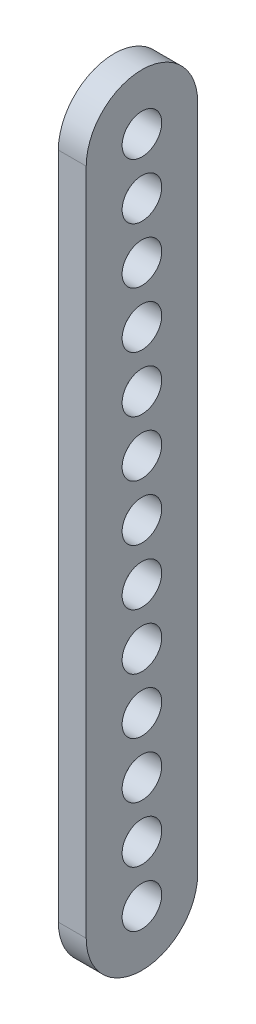
from build123d import *

# Parameters (mm, degrees)
BOSS_EXTRUDE1_DEPTH          = 2.5
F_5_32_0_14_DIAMETER_HOLE1_D = 3.556
LPATTERN1_COUNT              = 7
LPATTERN1_PITCH              = 5
MIRROR1_COPY_1_D             = 3.556
MIRROR1_COPY_2_D             = 3.556
MIRROR1_COPY_3_D             = 3.556
MIRROR1_COPY_4_D             = 3.556
MIRROR1_COPY_5_D             = 3.556
MIRROR1_COPY_6_D             = 3.556
MIRROR1_COPY_7_D             = 3.556


with BuildPart() as part:
    # Sketch1 → Boss-Extrude1 (new body)
    with BuildSketch(Plane(origin=(0, 0, 0), x_dir=(0, 0, -1), z_dir=(1, 0, 0))):
        with BuildLine():
            Line((5, 30), (5, -30))
            ThreePointArc((5, -30), (0, -35), (-5, -30))
            Line((-5, -30), (-5, 30))
            ThreePointArc((-5, 30), (0, 35), (5, 30))
        make_face()
    extrude(amount=BOSS_EXTRUDE1_DEPTH)

    # 5/32 (0.14) Diameter Hole1 (through all)
    with Locations(Plane(origin=(2.5, 0, 0), x_dir=(0, 0, -1), z_dir=(1, 0, 0))):
        with Locations((0, 0)):
            f_5_32_0_14_diameter_hole1 = Hole(F_5_32_0_14_DIAMETER_HOLE1_D / 2)

    # LPattern1: 5/32 (0.14) Diameter Hole1 ×7
    with Locations(*[(0, i * LPATTERN1_PITCH, 0) for i in range(1, LPATTERN1_COUNT)]):
        add(f_5_32_0_14_diameter_hole1, mode=Mode.SUBTRACT)

    # Mirror1 copy 1 (through all)
    with Locations(Plane(origin=(2.5, -5, 0), x_dir=(0, 0, -1), z_dir=(1, 0, 0))):
        with Locations((0, 0)):
            Hole(MIRROR1_COPY_1_D / 2)

    # Mirror1 copy 2 (through all)
    with Locations(Plane(origin=(2.5, -10, 0), x_dir=(0, 0, -1), z_dir=(1, 0, 0))):
        with Locations((0, 0)):
            Hole(MIRROR1_COPY_2_D / 2)

    # Mirror1 copy 3 (through all)
    with Locations(Plane(origin=(2.5, -15, 0), x_dir=(0, 0, -1), z_dir=(1, 0, 0))):
        with Locations((0, 0)):
            Hole(MIRROR1_COPY_3_D / 2)

    # Mirror1 copy 4 (through all)
    with Locations(Plane(origin=(2.5, -20, 0), x_dir=(0, 0, -1), z_dir=(1, 0, 0))):
        with Locations((0, 0)):
            Hole(MIRROR1_COPY_4_D / 2)

    # Mirror1 copy 5 (through all)
    with Locations(Plane(origin=(2.5, -25, 0), x_dir=(0, 0, -1), z_dir=(1, 0, 0))):
        with Locations((0, 0)):
            Hole(MIRROR1_COPY_5_D / 2)

    # Mirror1 copy 6 (through all)
    with Locations(Plane(origin=(2.5, -30, 0), x_dir=(0, 0, -1), z_dir=(1, 0, 0))):
        with Locations((0, 0)):
            Hole(MIRROR1_COPY_6_D / 2)

    # Mirror1 copy 7 (through all)
    with Locations(Plane(origin=(2.5, 0, 0), x_dir=(0, 0, -1), z_dir=(1, 0, 0))):
        with Locations((0, 0)):
            Hole(MIRROR1_COPY_7_D / 2)


solid = part.part
